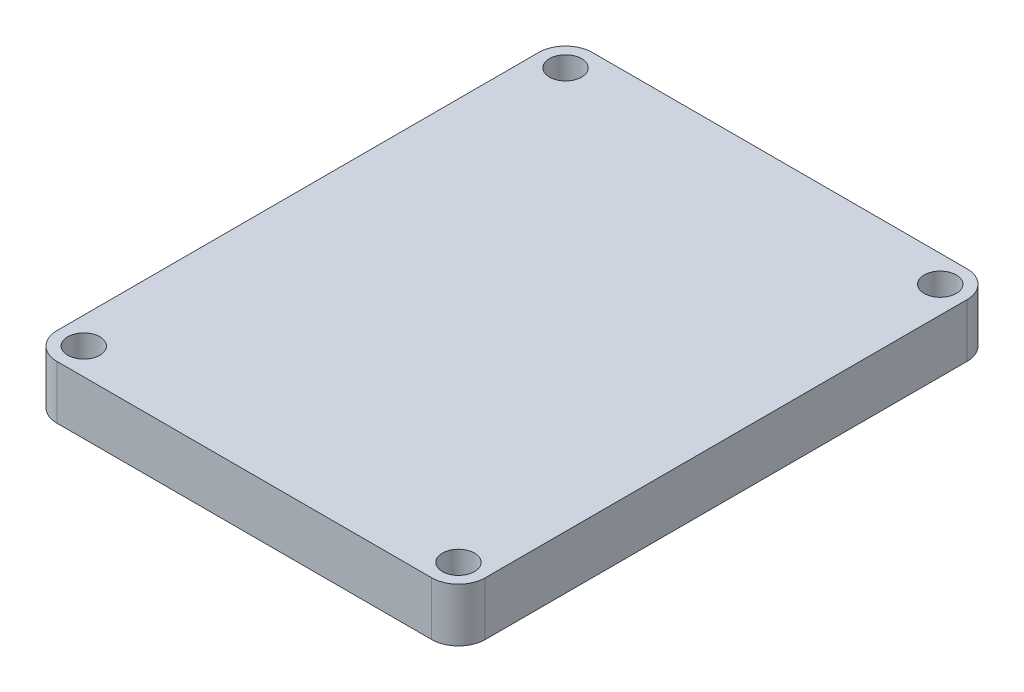
from build123d import *

# Parameters (mm, degrees)
SKETCH1_R           = 3
BOSS_EXTRUDE2_DEPTH = 10
FILLET1_R           = 5
FILLET2_R           = 5


with BuildPart() as part:
    # Sketch1 → Boss-Extrude2 (new body)
    # profile 1 of 2: a face of its own
    with BuildSketch(Plane(origin=(0, 0, 0), x_dir=(1, 0, 0), z_dir=(0, 1, 0))):
        with BuildLine():
            Line((9.310351883, 40.78525027), (-70.689648117, 40.78525027))
            Line((-70.689648117, 40.78525027), (-70.689648117, -54.21474973))
            Line((-70.689648117, -54.21474973), (-68.689648117, -54.21474973))
            ThreePointArc((-68.689648117, -54.21474973), (-65.689648117, -51.21474973), (-62.689648117, -54.21474973))
            ThreePointArc((-62.689648117, -54.21474973), (-63.568327773, -56.336070073), (-65.689648117, -57.21474973))
            Line((-65.689648117, -57.21474973), (-65.689648117, -59.21474973))
            Line((-65.689648117, -59.21474973), (9.310351883, -59.21474973))
            Line((9.310351883, -59.21474973), (9.310351883, 40.78525027))
        make_face()
        with Locations(Location((4.310351883, -54.21474973, 0), (0, 0, 270))):
            Circle(SKETCH1_R, mode=Mode.SUBTRACT)
        with Locations(Location((-65.689648117, 35.78525027, 0), (0, 0, 270))):
            Circle(SKETCH1_R, mode=Mode.SUBTRACT)
        with Locations(Location((4.310351883, 35.78525027, 0), (0, 0, 270))):
            Circle(SKETCH1_R, mode=Mode.SUBTRACT)
    # profile 2 of 2: a face of its own
    with BuildSketch(Plane(origin=(0, 0, 0), x_dir=(1, 0, 0), z_dir=(0, 1, 0))):
        with BuildLine():
            Line((-68.689648117, -54.21474973), (-70.689648117, -54.21474973))
            Line((-70.689648117, -54.21474973), (-70.689648117, -59.21474973))
            Line((-70.689648117, -59.21474973), (-65.689648117, -59.21474973))
            Line((-65.689648117, -59.21474973), (-65.689648117, -57.21474973))
            ThreePointArc((-65.689648117, -57.21474973), (-67.81096846, -56.336070073), (-68.689648117, -54.21474973))
        make_face()
    extrude(amount=BOSS_EXTRUDE2_DEPTH)

    # Fillet1
    fillet1_edges = [part.edges().sort_by_distance(p)[0] for p in [
        (-70.689648117, 5, 59.21474973),
    ]]
    fillet(fillet1_edges, radius=FILLET1_R)

    # Fillet2
    fillet2_edges = [part.edges().sort_by_distance(p)[0] for p in [
        (-70.689648117, 5, -40.78525027),
        (9.310351883, 5, -40.78525027),
        (9.310351883, 5, 59.21474973),
    ]]
    fillet(fillet2_edges, radius=FILLET2_R)


solid = part.part
